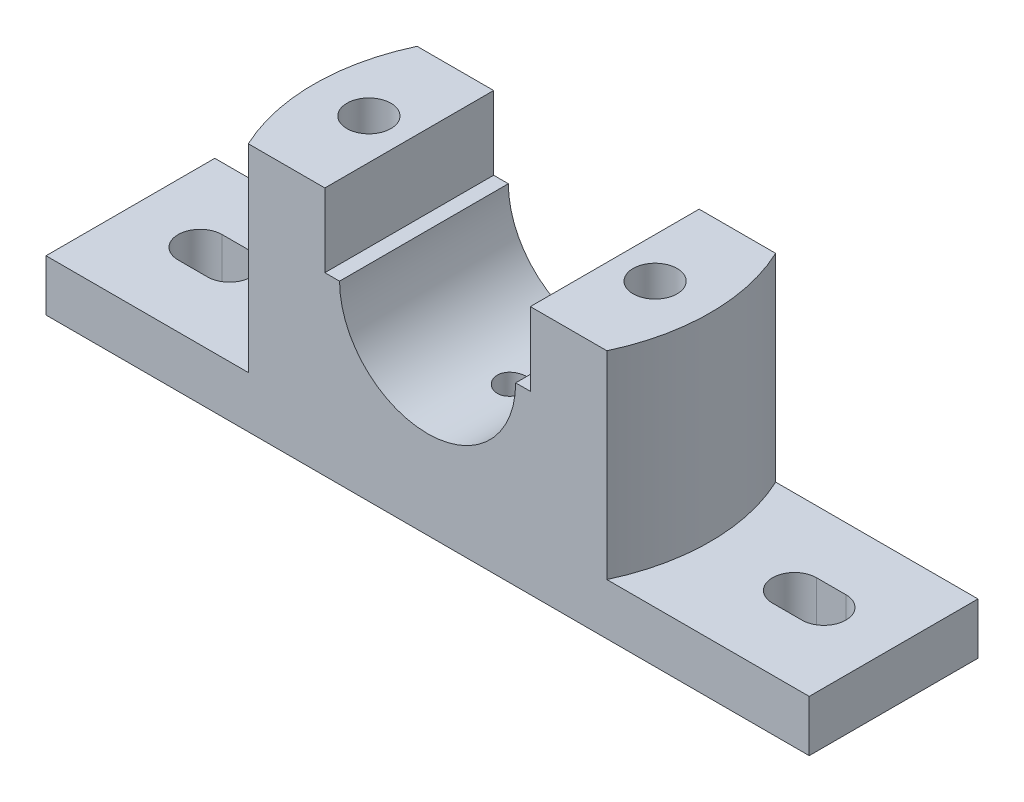
from build123d import *

# Parameters (mm, degrees)
SKETCH1_W           = 208
SKETCH1_H           = 46
BOSS_EXTRUDE1_DEPTH = 14
SKETCH2_R           = 6
BOSS_EXTRUDE2_DEPTH = 54
SKETCH3_W           = 28
SKETCH3_H           = 28
CUT_EXTRUDE1_DEPTH  = 12
CUT_EXTRUDE2_START  = -12
SKETCH4_R           = 6
CUT_EXTRUDE2_DEPTH  = 12
SKETCH5_W           = 195
SKETCH5_H           = 33
CUT_EXTRUDE3_DEPTH  = 2
CUT_EXTRUDE4_DEPTH  = 133.4990566
SKETCH8_R           = 4
CUT_EXTRUDE7_DEPTH  = 126.303631232
SKETCH8_2_R         = 4
BOSS_EXTRUDE3_DEPTH = 16


with BuildPart() as part:
    # Sketch1 → Boss-Extrude1 (new body)
    with BuildSketch(Plane(origin=(0, 0, 0), x_dir=(1, 0, 0), z_dir=(0, 1, 0))):
        Rectangle(SKETCH1_W, SKETCH1_H)
        with BuildLine():
            Line((-85, 6), (-77, 6))
            ThreePointArc((-77, 6), (-71, 0), (-77, -6))
            Line((-77, -6), (-85, -6))
            ThreePointArc((-85, -6), (-91, 0), (-85, 6))
        make_face(mode=Mode.SUBTRACT)
        with BuildLine():
            Line((85, -6), (77, -6))
            ThreePointArc((77, -6), (71, 0), (77, 6))
            Line((77, 6), (85, 6))
            ThreePointArc((85, 6), (91, 0), (85, -6))
        make_face(mode=Mode.SUBTRACT)
    extrude(amount=BOSS_EXTRUDE1_DEPTH)

    # Sketch2 → Boss-Extrude2 (add)
    with BuildSketch(Plane(origin=(0, 14, 0), x_dir=(1, 0, 0), z_dir=(0, 1, 0))):
        with BuildLine():
            Line((-48.856934001, 23), (48.856934001, 23))
            ThreePointArc((48.856934001, 23), (54, 0), (48.856934001, -23))
            Line((48.856934001, -23), (-48.856934001, -23))
            ThreePointArc((-48.856934001, -23), (-54, 0), (-48.856934001, 23))
        make_face()
        with Locations((-39, 0)):
            Circle(SKETCH2_R, mode=Mode.SUBTRACT)
        with Locations((39, 0)):
            Circle(SKETCH2_R, mode=Mode.SUBTRACT)
    extrude(amount=BOSS_EXTRUDE2_DEPTH)

    # Sketch3 → Cut-Extrude1 (cut)
    with BuildSketch(Plane.XZ):
        with Locations((-39, 0)):
            Rectangle(SKETCH3_W, SKETCH3_H)
        with Locations((39, 0)):
            Rectangle(SKETCH3_W, SKETCH3_H)
    extrude(amount=-CUT_EXTRUDE1_DEPTH, mode=Mode.SUBTRACT)

    # Sketch4 → Cut-Extrude2 (cut)
    with BuildSketch(Plane(origin=(0, 14, 0), x_dir=(1, 0, 0), z_dir=(0, 1, 0)).offset(CUT_EXTRUDE2_START)):
        with Locations((39, 0)):
            Circle(SKETCH4_R)
        with Locations((-39, 0)):
            Circle(SKETCH4_R)
    extrude(amount=CUT_EXTRUDE2_DEPTH, mode=Mode.SUBTRACT)

    # Sketch5 → Cut-Extrude3 (cut)
    with BuildSketch(Plane.XZ):
        Rectangle(SKETCH5_W, SKETCH5_H)
    extrude(amount=-CUT_EXTRUDE3_DEPTH, mode=Mode.SUBTRACT)

    # Sketch6 → Cut-Extrude4 (cut, through all)
    with BuildSketch(Plane.XY.offset(23)):
        with BuildLine():
            Line((-28, 68), (-28, 48))
            Line((-28, 48), (-24, 48))
            ThreePointArc((-24, 48), (0, 24), (24, 48))
            Line((24, 48), (28, 48))
            Line((28, 48), (28, 68))
            Line((28, 68), (-28, 68))
        make_face()
    extrude(amount=-CUT_EXTRUDE4_DEPTH, mode=Mode.SUBTRACT)

    # Sketch8 → Cut-Extrude7 (cut, through all)
    with BuildSketch(Plane.XZ.offset(-2)):
        Circle(SKETCH8_R)
    extrude(amount=-CUT_EXTRUDE7_DEPTH, mode=Mode.SUBTRACT)

    # Sketch8<2> → Boss-Extrude3 (add)
    with BuildSketch(Plane.XZ.offset(-2)):
        Circle(SKETCH8_2_R)
    extrude(amount=-BOSS_EXTRUDE3_DEPTH)


solid = part.part
